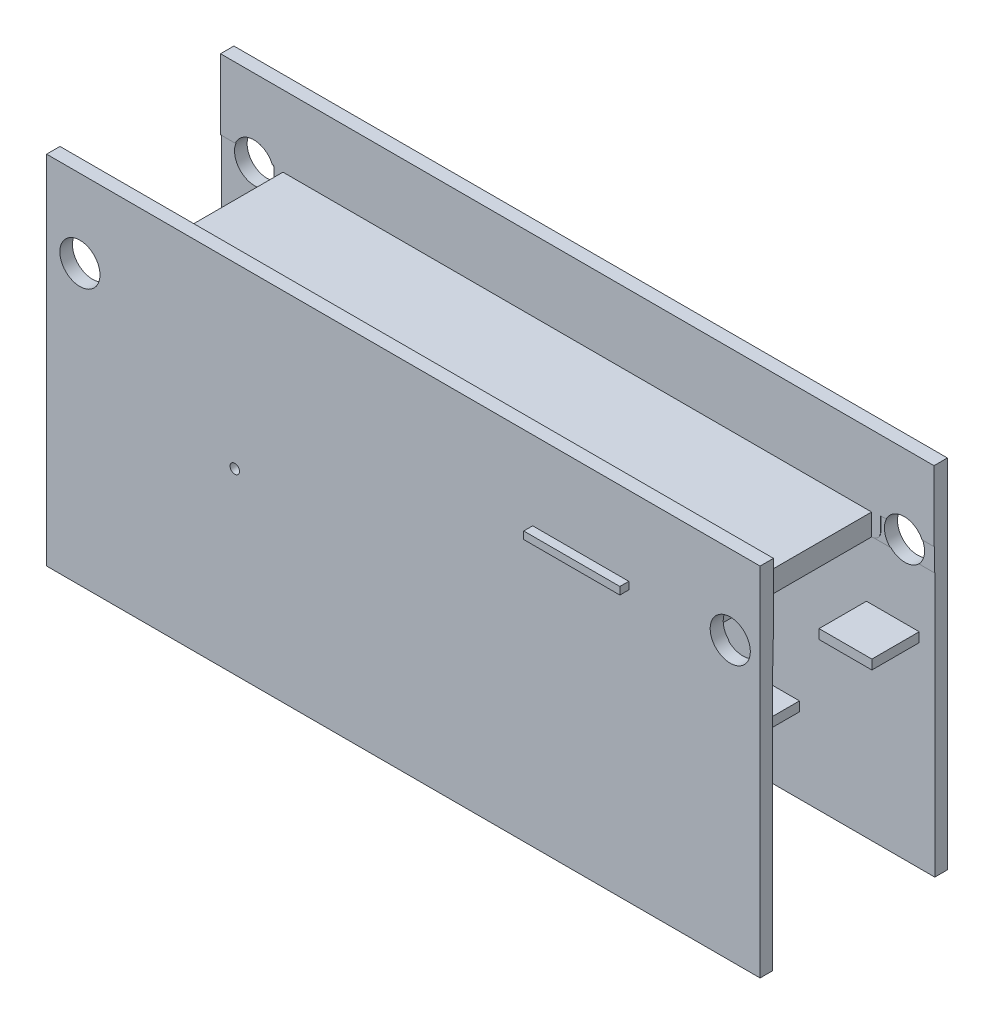
from build123d import *

# Parameters (mm, degrees)
SKETCH1_W               = 400
SKETCH1_H               = 200
BOSS_EXTRUDE1_DEPTH     = 52.5
SKETCH2_W               = 400
SKETCH2_H               = 90
CUT_EXTRUDE2_DEPTH      = 40
SKETCH3_W               = 90.375416362
SKETCH3_H               = 10.805756305
CUT_EXTRUDE4_DEPTH      = 30
SKETCH6_W               = 90.866587104
SKETCH6_H               = 12.770439269
CUT_EXTRUDE5_DEPTH      = 30
SKETCH7_W               = 90.866587104
SKETCH7_H               = 151.035002888
CUT_EXTRUDE6_DEPTH      = 416.639567414
SKETCH8_W               = 30
SKETCH8_H               = 90.375416362
CUT_EXTRUDE7_DEPTH      = 256.367226621
SKETCH11_R              = 11.25
CUT_EXTRUDE8_DEPTH      = 248.032386541
FILLET6_R               = 5
CUT_EXTRUDE9_DEPTH      = 248.032386541
CUT_EXTRUDE9_DEPTH_BACK = 248.032386541
SKETCH12_R              = 11.25
FILLET7_R               = 5
SKETCH19_W              = 5.960521718
SKETCH19_H              = 90
CUT_EXTRUDE11_DEPTH     = 262.450282081
SKETCH20_W              = 5
SKETCH20_H              = 90
CUT_EXTRUDE12_DEPTH     = 262.450282081
BOSS_EXTRUDE7_REACH     = 249.032
SKETCH29_W              = 29.604200123
SKETCH29_H              = 5.313574381
SKETCH30_W              = 40.6
SKETCH30_H              = 6.563827177
CUT_EXTRUDE16_DEPTH     = 416.639567414
SKETCH31_R              = 2.65
CUT_EXTRUDE17_DEPTH     = 10
SKETCH32_W              = 53.894825864
SKETCH32_H              = 4.174951299
BOSS_EXTRUDE8_DEPTH     = 5
SKETCH33_W              = 38.657413524
SKETCH33_H              = 4.433580482
BOSS_EXTRUDE9_DEPTH     = 5


with BuildPart() as part:
    # Sketch1 → Boss-Extrude1 (new, symmetric)
    with BuildSketch(Plane.XY):
        Rectangle(SKETCH1_W, SKETCH1_H)
    extrude(amount=BOSS_EXTRUDE1_DEPTH, both=True)

    # Sketch2 → Cut-Extrude2 (cut)
    with BuildSketch(Plane(origin=(0, 100, 0), x_dir=(1, 0, 0), z_dir=(0, 1, 0))):
        Rectangle(SKETCH2_W, SKETCH2_H)
    extrude(amount=-CUT_EXTRUDE2_DEPTH, mode=Mode.SUBTRACT)

    # Sketch3 → Cut-Extrude4 (cut)
    with BuildSketch(Plane(origin=(200, 0, 0), x_dir=(0, 0, -1), z_dir=(1, 0, 0))):
        with Locations((0, 55.256708374)):
            Rectangle(SKETCH3_W, SKETCH3_H)
    extrude(amount=-CUT_EXTRUDE4_DEPTH, mode=Mode.SUBTRACT)

    # Sketch6 → Cut-Extrude5 (cut)
    with BuildSketch(Plane.ZY.offset(200)):
        with Locations((0, 54.274366892)):
            Rectangle(SKETCH6_W, SKETCH6_H)
    extrude(amount=-CUT_EXTRUDE5_DEPTH, mode=Mode.SUBTRACT)

    # Sketch7 → Cut-Extrude6 (cut, through all)
    with BuildSketch(Plane.ZY.offset(200)):
        with Locations((0, -27.628354187)):
            Rectangle(SKETCH7_W, SKETCH7_H)
    extrude(amount=-CUT_EXTRUDE6_DEPTH, mode=Mode.SUBTRACT)

    # Sketch8 → Cut-Extrude7 (cut, through all)
    with BuildSketch(Plane(origin=(0, 49.853830221, 0), x_dir=(1, 0, 0), z_dir=(0, 1, 0))):
        with Locations((185, 0)):
            Rectangle(SKETCH8_W, SKETCH8_H)
    extrude(amount=-CUT_EXTRUDE7_DEPTH, mode=Mode.SUBTRACT)

    # Sketch11 → Cut-Extrude8 (cut, through all)
    with BuildSketch(Plane(origin=(0, 0, -52.5), x_dir=(-1, 0, 0), z_dir=(0, 0, -1))):
        with Locations((-183.256148082, 55.698181941)):
            Circle(SKETCH11_R)
    extrude(amount=-CUT_EXTRUDE8_DEPTH, mode=Mode.SUBTRACT)

    # Fillet6
    fillet6_edges = [part.edges().sort_by_distance(p)[0] for p in [
        (-170, 47.889147257, 0),
        (-170, 60, 0),
    ]]
    fillet(fillet6_edges, radius=FILLET6_R)

    # Sketch12 → Cut-Extrude9 (cut, two sides: drawn at the far end of the back side and taken through both)
    with BuildSketch(Plane.XY.offset(52.5).offset(-CUT_EXTRUDE9_DEPTH_BACK)):
        with Locations((-181.329803839, 56.296045727)):
            Circle(SKETCH12_R)
    extrude(amount=CUT_EXTRUDE9_DEPTH + CUT_EXTRUDE9_DEPTH_BACK, mode=Mode.SUBTRACT)

    # Fillet7
    fillet7_edges = [part.edges().sort_by_distance(p)[0] for p in [
        (170, 60, 0),
        (170, 47.889147257, 0),
    ]]
    fillet(fillet7_edges, radius=FILLET7_R)

    # Sketch19 → Cut-Extrude11 (cut, through all)
    with BuildSketch(Plane(origin=(0, 60, 0), x_dir=(1, 0, 0), z_dir=(0, 1, 0))):
        with Locations((-167.980260859, 0)):
            Rectangle(SKETCH19_W, SKETCH19_H)
    extrude(amount=-CUT_EXTRUDE11_DEPTH, mode=Mode.SUBTRACT)

    # Sketch20 → Cut-Extrude12 (cut, through all)
    with BuildSketch(Plane(origin=(0, 60, 0), x_dir=(1, 0, 0), z_dir=(0, 1, 0))):
        with Locations((167.5, 0)):
            Rectangle(SKETCH20_W, SKETCH20_H)
    extrude(amount=-CUT_EXTRUDE12_DEPTH, mode=Mode.SUBTRACT)

    # Sketch29 → Boss-Extrude7 (add, up to next)
    with BuildSketch(Plane.XY.offset(52.5), mode=Mode.PRIVATE) as boss_extrude7_sk1:
        with Locations((176.486577654, 12.14531287)):
            Rectangle(SKETCH29_W, SKETCH29_H)
    boss_extrude7_tool1 = extrude(boss_extrude7_sk1.sketch, amount=-BOSS_EXTRUDE7_REACH, mode=Mode.PRIVATE) - part.part
    add(boss_extrude7_tool1.solids().sort_by_distance((176.486578, 12.145313, 52.5))[0])

    # Sketch30 → Cut-Extrude16 (cut, through all)
    with BuildSketch(Plane(origin=(200, 0, 0), x_dir=(0, 0, -1), z_dir=(1, 0, 0))):
        with Locations((-1.424009181, 12.770439269)):
            Rectangle(SKETCH30_W, SKETCH30_H)
    extrude(amount=-CUT_EXTRUDE16_DEPTH, mode=Mode.SUBTRACT)

    # Sketch31 → Cut-Extrude17 (cut)
    with BuildSketch(Plane.XY.offset(52.5)):
        with Locations((-94.505715776, 0)):
            Circle(SKETCH31_R)
    extrude(amount=-CUT_EXTRUDE17_DEPTH, mode=Mode.SUBTRACT)

    # Sketch32 → Boss-Extrude8 (add)
    with BuildSketch(Plane.XY.offset(52.5)):
        with Locations((99.43974913, 53.705055351)):
            Rectangle(SKETCH32_W, SKETCH32_H)
    extrude(amount=BOSS_EXTRUDE8_DEPTH)

    # Sketch33 → Boss-Extrude9 (add)
    with BuildSketch(Plane(origin=(0, 0, -52.5), x_dir=(-1, 0, 0), z_dir=(0, 0, -1))):
        with Locations((-111.744568027, 56.347904824)):
            Rectangle(SKETCH33_W, SKETCH33_H)
    extrude(amount=BOSS_EXTRUDE9_DEPTH)


solid = part.part
